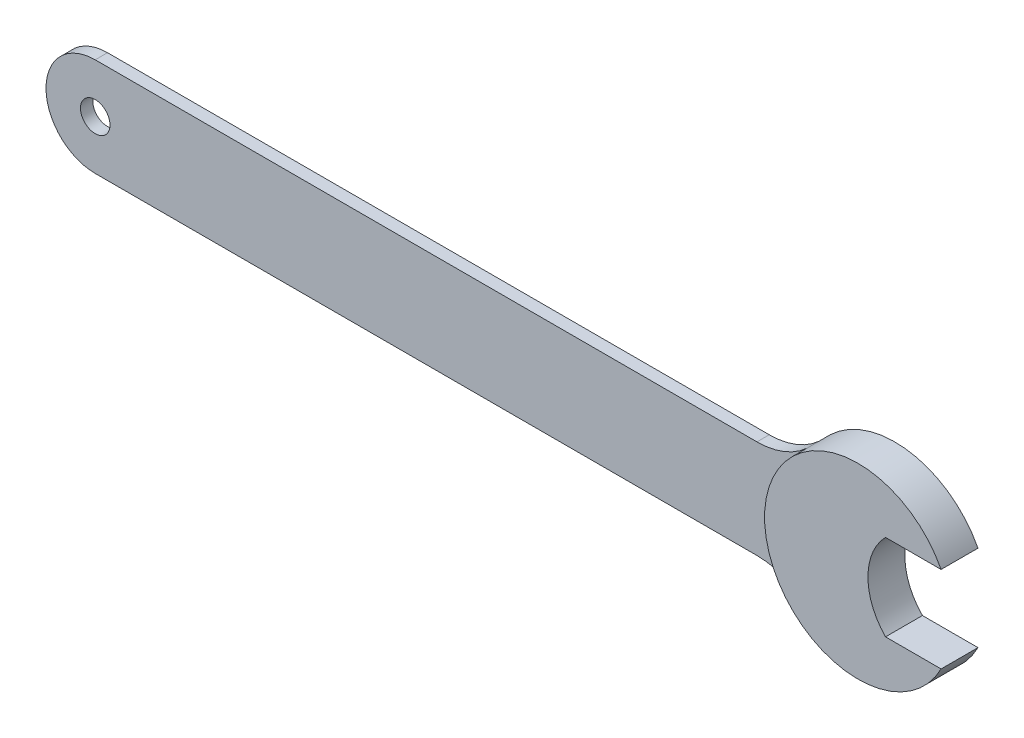
from build123d import *

# Parameters (mm, degrees)
SKETCH1_R           = 6
BOSS_EXTRUDE1_DEPTH = 2.5
BOSS_EXTRUDE2_DEPTH = 7.5


with BuildPart() as part:
    # Sketch1 → Boss-Extrude1 (new, symmetric)
    with BuildSketch(Plane.XY):
        with BuildLine():
            Line((268.913125513, 20), (0, 20))
            ThreePointArc((0, 20), (-20, 0), (0, -20))
            Line((0, -20), (268.913125513, -20))
            ThreePointArc((268.913125513, -20), (279.827228639, -22.055727726), (289.245570139, -27.941176471))
            ThreePointArc((289.245570139, -27.941176471), (277, 0), (289.245570139, 27.941176471))
            ThreePointArc((289.245570139, 27.941176471), (279.827228639, 22.055727726), (268.913125513, 20))
        make_face()
        Circle(SKETCH1_R, mode=Mode.SUBTRACT)
    extrude(amount=BOSS_EXTRUDE1_DEPTH, both=True)

    # Sketch1<3> → Boss-Extrude2 (add, symmetric)
    with BuildSketch(Plane.XY):
        with BuildLine():
            Line((348.730549951, -17.5), (326.146428929, -17.5))
            ThreePointArc((326.146428929, -17.5), (319, 0), (326.146428929, 17.5))
            Line((326.146428929, 17.5), (348.730549951, 17.5))
            ThreePointArc((348.730549951, 17.5), (277, 0), (348.730549951, -17.5))
        make_face()
    extrude(amount=BOSS_EXTRUDE2_DEPTH, both=True)


solid = part.part
